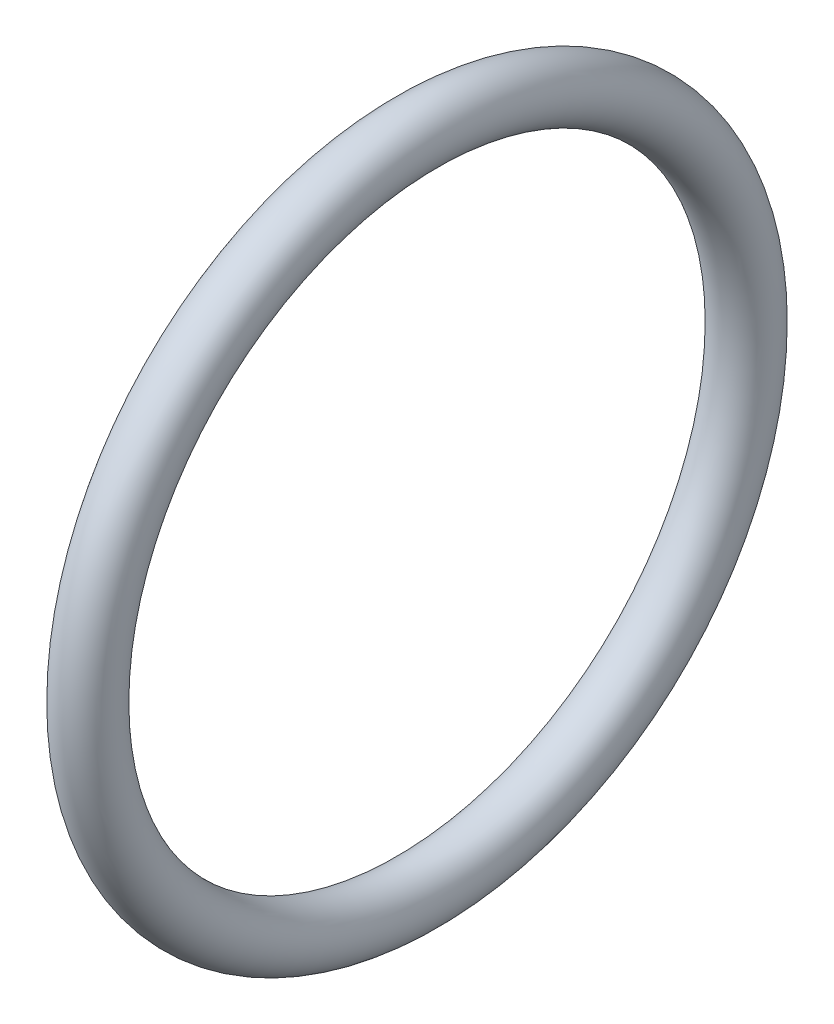
from build123d import *

# Parameters (mm, degrees)
SKETCH2_R = 1.5875


with BuildPart() as part:
    # Sketch2 → Revolve1 (revolve)
    with BuildSketch(Plane.XY, mode=Mode.PRIVATE) as revolve1_sk:
        with Locations((0, 18)):
            Circle(SKETCH2_R)
    revolve(revolve1_sk.sketch.rotate(Axis((0, 0, 0), (1, 0, 0)), 90), axis=Axis((0, 0, 0), (1, 0, 0)))


solid = part.part
